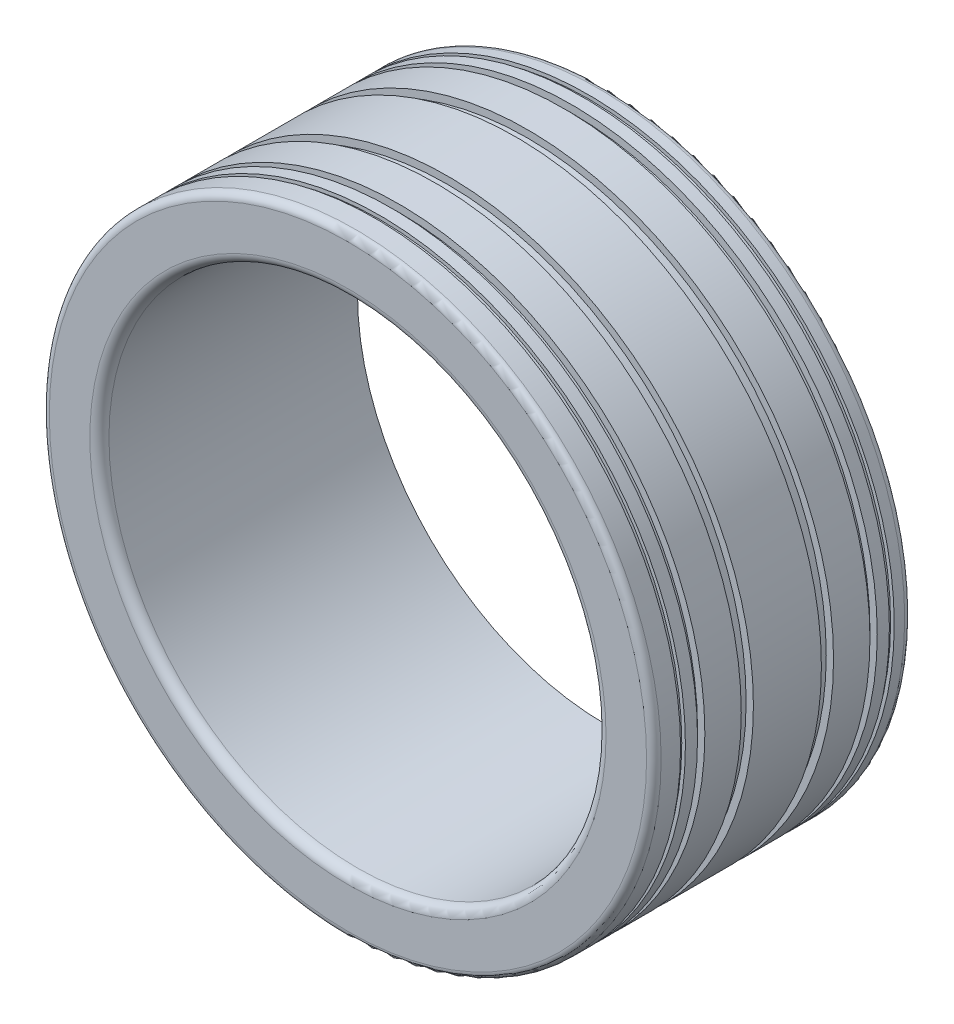
from build123d import *

# Parameters (mm, degrees)
CROQUIS1_R              = 32
CROQUIS1_R_2            = 26
SALIENTE_EXTRUIR1_DEPTH = 27
REDONDEO1_R             = 0.762
CROQUIS2_W              = 0.762
CROQUIS2_H              = 0.762
CROQUIS2_H_2            = 1.27
CROQUIS2_W_2            = 0.381
CROQUIS2_H_3            = 0.508
FILLET1_R               = 1


with BuildPart() as part:
    # Croquis1 → Saliente-Extruir1 (new body)
    with BuildSketch(Plane.XY):
        Circle(CROQUIS1_R)
        Circle(CROQUIS1_R_2, mode=Mode.SUBTRACT)
    extrude(amount=-SALIENTE_EXTRUIR1_DEPTH)

    # Redondeo1
    redondeo1_edges = [part.edges().sort_by_distance(p)[0] for p in [
        (-32, 0, 0),
        (-32, 0, -27),
    ]]
    fillet(redondeo1_edges, radius=REDONDEO1_R)

    # Croquis2 → Cortar-Revolución1 (revolve, cut)
    with BuildSketch(Plane(origin=(0, 0, 0), x_dir=(1, 0, 0), z_dir=(0, 1, 0)), mode=Mode.PRIVATE) as cortar_revoluci_n1_sk:
        with Locations((-31.619, 22.987)):
            Rectangle(CROQUIS2_W, CROQUIS2_H)
        with Locations((-31.619, 18.161)):
            Rectangle(CROQUIS2_W, CROQUIS2_H_2)
        with Locations((-31.8095, 24.892)):
            Rectangle(CROQUIS2_W_2, CROQUIS2_H_3)
        with Locations((-31.619, 9.779)):
            Rectangle(CROQUIS2_W, CROQUIS2_H_2)
        with Locations((-31.619, 4.953)):
            Rectangle(CROQUIS2_W, CROQUIS2_H)
        with Locations((-31.8095, 3.048)):
            Rectangle(CROQUIS2_W_2, CROQUIS2_H_3)
    revolve(cortar_revoluci_n1_sk.sketch.rotate(Axis((0, 0, 0), (0, 0, -1)), 180), axis=Axis((0, 0, 0), (0, 0, -1)), mode=Mode.SUBTRACT)

    # Fillet1
    fillet1_edges = [part.edges().sort_by_distance(p)[0] for p in [
        (-26, 0, 0),
    ]]
    fillet(fillet1_edges, radius=FILLET1_R)


solid = part.part
